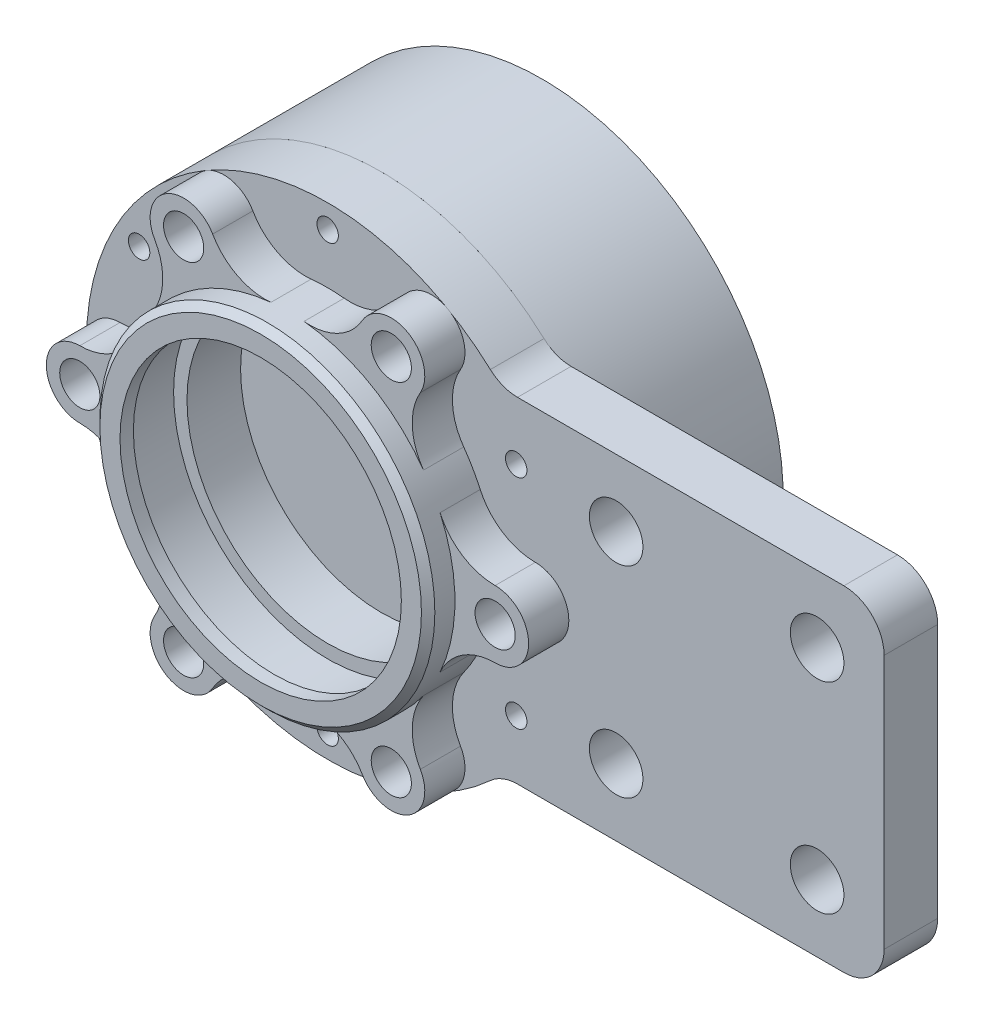
from build123d import *

# Parameters (mm, degrees)
SKETCH_1_R          = 12.5
SKETCH_1_R_2        = 10.5
EXTRUDE_1_DEPTH     = 1
EXTRUDE_START       = 4
SKETCH_2_R          = 12.5
SKETCH_2_R_2        = 11.5
EXTRUDE_2_DEPTH     = 4
SKETCH_3_R          = 1.5
EXTRUDE_4_DEPTH     = 3
SKETCH_4_R          = 1.25
SKETCH_4_R_2        = 10.5
EXTRUDE_5_DEPTH     = 4
CHAMFER_1_SIZE      = 0.5
CUT_EXTRUDE_1_DEPTH = 10
SKETCH_14_R         = 1.25
EXTRUDE_6_DEPTH     = 4
SKETCH_15_R         = 18
EXTRUDE_7_DEPTH     = 12
SKETCH_18_R         = 0.8
CUT_EXTRUDE_2_DEPTH = 4
EXTRUDE_8_DEPTH     = 4
SKETCH_20_R         = 2
CUT_EXTRUDE_3_DEPTH = 4
FILLET_1_R          = 3


with BuildPart() as part:
    # 草图1 → 凸台-拉伸1 (new body)
    with BuildSketch(Plane.XY):
        Circle(SKETCH_1_R)
        Circle(SKETCH_1_R_2, mode=Mode.SUBTRACT)
    extrude(amount=EXTRUDE_1_DEPTH)

    # 草图2 → 凸台-拉伸2 (add)
    with BuildSketch(Plane(origin=(0, 0, 0), x_dir=(-1, 0, 0), z_dir=(0, 0, -1)).offset(EXTRUDE_START)):
        Circle(SKETCH_2_R)
        Circle(SKETCH_2_R_2, mode=Mode.SUBTRACT)
    extrude(amount=-EXTRUDE_2_DEPTH)

    # 草图3 → 凸台-拉伸4 (add)
    # profile 1 of 6: a face of its own
    with BuildSketch(Plane(origin=(0, 0, -4), x_dir=(-1, 0, 0), z_dir=(0, 0, -1))):
        with BuildLine():
            ThreePointArc((9.915063383, 12.173393832), (8.999999927, 15.588457141), (5.584936617, 14.673393685))
            ThreePointArc((5.584936617, 14.673393685), (3.73765178, 12.915125295), (1.232179975, 12.439121051))
            ThreePointArc((1.232179975, 12.439121051), (6.25, 10.825317547), (10.156504843, 7.286659685))
            ThreePointArc((10.156504843, 7.286659685), (9.316000708, 9.694464039), (9.915063383, 12.173393832))
        make_face()
        with Locations((7.75, 13.423393759)):
            Circle(SKETCH_3_R, mode=Mode.SUBTRACT)
    # profile 2 of 6: a face of its own
    with BuildSketch(Plane(origin=(0, 0, -4), x_dir=(-1, 0, 0), z_dir=(0, 0, -1))):
        with BuildLine():
            ThreePointArc((-11.388684818, 5.152461365), (-12.5, 0), (-11.388684818, -5.152461365))
            ThreePointArc((-11.388684818, -5.152461365), (-13.053652488, -3.220661256), (-15.5, -2.499999853))
            ThreePointArc((-15.5, -2.499999853), (-17.999999853, 0), (-15.5, 2.499999853))
            ThreePointArc((-15.5, 2.499999853), (-13.053652488, 3.220661256), (-11.388684818, 5.152461365))
        make_face()
        with Locations((-15.5, 0)):
            Circle(SKETCH_3_R, mode=Mode.SUBTRACT)
    # profile 3 of 6: a face of its own
    with BuildSketch(Plane(origin=(0, 0, -4), x_dir=(-1, 0, 0), z_dir=(0, 0, -1))):
        with BuildLine():
            ThreePointArc((15.5, 2.499999853), (13.053652488, 3.220661256), (11.388684818, 5.152461365))
            ThreePointArc((11.388684818, 5.152461365), (12.5, 0), (11.388684818, -5.152461365))
            ThreePointArc((11.388684818, -5.152461365), (13.053652488, -3.220661256), (15.5, -2.499999853))
            ThreePointArc((15.5, -2.499999853), (17.999999853, 0), (15.5, 2.499999853))
        make_face()
        with Locations((15.5, 0)):
            Circle(SKETCH_3_R, mode=Mode.SUBTRACT)
    # profile 4 of 6: a face of its own
    with BuildSketch(Plane(origin=(0, 0, -4), x_dir=(-1, 0, 0), z_dir=(0, 0, -1))):
        with BuildLine():
            ThreePointArc((9.915063383, -12.173393832), (9.316000708, -9.694464039), (10.156504843, -7.286659685))
            ThreePointArc((10.156504843, -7.286659685), (6.25, -10.825317547), (1.232179975, -12.439121051))
            ThreePointArc((1.232179975, -12.439121051), (3.73765178, -12.915125295), (5.584936617, -14.673393685))
            ThreePointArc((5.584936617, -14.673393685), (8.999999927, -15.588457141), (9.915063383, -12.173393832))
        make_face()
        with Locations((7.75, -13.423393759)):
            Circle(SKETCH_3_R, mode=Mode.SUBTRACT)
    # profile 5 of 6: a face of its own
    with BuildSketch(Plane(origin=(0, 0, -4), x_dir=(-1, 0, 0), z_dir=(0, 0, -1))):
        with BuildLine():
            ThreePointArc((-5.584936617, -14.673393685), (-3.73765178, -12.915125295), (-1.232179975, -12.439121051))
            ThreePointArc((-1.232179975, -12.439121051), (-6.25, -10.825317547), (-10.156504843, -7.286659685))
            ThreePointArc((-10.156504843, -7.286659685), (-9.316000708, -9.694464039), (-9.915063383, -12.173393832))
            ThreePointArc((-9.915063383, -12.173393832), (-8.999999927, -15.588457141), (-5.584936617, -14.673393685))
        make_face()
        with Locations((-7.75, -13.423393759)):
            Circle(SKETCH_3_R, mode=Mode.SUBTRACT)
    # profile 6 of 6: a face of its own
    with BuildSketch(Plane(origin=(0, 0, -4), x_dir=(-1, 0, 0), z_dir=(0, 0, -1))):
        with BuildLine():
            ThreePointArc((-9.915063383, 12.173393832), (-9.316000708, 9.694464039), (-10.156504843, 7.286659685))
            ThreePointArc((-10.156504843, 7.286659685), (-6.25, 10.825317547), (-1.232179975, 12.439121051))
            ThreePointArc((-1.232179975, 12.439121051), (-3.73765178, 12.915125295), (-5.584936617, 14.673393685))
            ThreePointArc((-5.584936617, 14.673393685), (-8.999999927, 15.588457141), (-9.915063383, 12.173393832))
        make_face()
        with Locations((-7.75, 13.423393759)):
            Circle(SKETCH_3_R, mode=Mode.SUBTRACT)
    extrude(amount=-EXTRUDE_4_DEPTH)

    # 倒角1
    chamfer_1_edges = [part.edges().sort_by_distance(p)[0] for p in [
        (-12.5, 0, 1),
    ]]
    chamfer(chamfer_1_edges, length=CHAMFER_1_SIZE)


with BuildPart() as body_2:
    # 草图4 → 凸台-拉伸5 (new body)
    with BuildSketch(Plane(origin=(0, 0, -4), x_dir=(-1, 0, 0), z_dir=(0, 0, -1))):
        with BuildLine():
            Line((-18, 0), (-18, -26))
            Line((-18, -26), (18, -26))
            Line((18, -26), (18, 0))
            ThreePointArc((18, 0), (0, 18), (-18, 0))
        make_face()
        with Locations((7.75, 13.423393759)):
            Circle(SKETCH_4_R, mode=Mode.SUBTRACT)
        Circle(SKETCH_4_R_2, mode=Mode.SUBTRACT)
        with Locations((13.423393759, 7.75)):
            Circle(SKETCH_4_R, mode=Mode.SUBTRACT)
        with Locations((15.5, 0)):
            Circle(SKETCH_4_R, mode=Mode.SUBTRACT)
        with Locations((13.423393759, -7.75)):
            Circle(SKETCH_4_R, mode=Mode.SUBTRACT)
        with Locations((7.75, -13.423393759)):
            Circle(SKETCH_4_R, mode=Mode.SUBTRACT)
        with Locations((0, -15.5)):
            Circle(SKETCH_4_R, mode=Mode.SUBTRACT)
        with Locations((-7.75, -13.423393759)):
            Circle(SKETCH_4_R, mode=Mode.SUBTRACT)
        with Locations((-13.423393759, -7.75)):
            Circle(SKETCH_4_R, mode=Mode.SUBTRACT)
        with Locations((-15.5, 0)):
            Circle(SKETCH_4_R, mode=Mode.SUBTRACT)
        with Locations((-13.423393759, 7.75)):
            Circle(SKETCH_4_R, mode=Mode.SUBTRACT)
        with Locations((-7.75, 13.423393759)):
            Circle(SKETCH_4_R, mode=Mode.SUBTRACT)
        with Locations((0, 15.5)):
            Circle(SKETCH_4_R, mode=Mode.SUBTRACT)
    extrude(amount=EXTRUDE_5_DEPTH)

    # 草图13 → 切除-拉伸1 (cut)
    with BuildSketch(Plane(origin=(0, 0, -8), x_dir=(-1, 0, 0), z_dir=(0, 0, -1))):
        with BuildLine():
            ThreePointArc((18, 0), (0, -18), (-18, 0))
            Line((-18, 0), (-18, -26))
            Line((-18, -26), (18, -26))
            Line((18, -26), (18, 0))
        make_face()
    extrude(amount=-CUT_EXTRUDE_1_DEPTH, mode=Mode.SUBTRACT)

    # 草图14 → 凸台-拉伸6 (add)
    with BuildSketch(Plane.XY.offset(-4)):
        with Locations((0, 15.5)):
            Circle(SKETCH_14_R)
        with Locations((13.423393759, 7.75)):
            Circle(SKETCH_14_R)
        with Locations((13.423393759, -7.75)):
            Circle(SKETCH_14_R)
        with Locations((0, -15.5)):
            Circle(SKETCH_14_R)
        with Locations((-13.423393759, -7.75)):
            Circle(SKETCH_14_R)
        with Locations((-13.423393759, 7.75)):
            Circle(SKETCH_14_R)
    extrude(amount=-EXTRUDE_6_DEPTH)

    # 草图18 → 切除-拉伸2 (cut)
    with BuildSketch(Plane(origin=(0, 0, -8), x_dir=(-1, 0, 0), z_dir=(0, 0, -1))):
        with Locations((0, 16.25)):
            Circle(SKETCH_18_R)
        with Locations((14.072912811, 8.125)):
            Circle(SKETCH_18_R)
        with Locations((14.072912811, -8.125)):
            Circle(SKETCH_18_R)
        with Locations((0, -16.25)):
            Circle(SKETCH_18_R)
        with Locations((-14.072912811, -8.125)):
            Circle(SKETCH_18_R)
        with Locations((-14.072912811, 8.125)):
            Circle(SKETCH_18_R)
    extrude(amount=-CUT_EXTRUDE_2_DEPTH, mode=Mode.SUBTRACT)

    # 草图19 → 凸台-拉伸8 (add)
    with BuildSketch(Plane(origin=(0, 0, -8), x_dir=(-1, 0, 0), z_dir=(0, 0, -1))):
        with BuildLine():
            Line((-41.531361747, -12.5), (-12.951833847, -12.5))
            ThreePointArc((-12.951833847, -12.5), (-18, 0), (-12.951833847, 12.5))
            Line((-12.951833847, 12.5), (-41.531361747, 12.5))
            Line((-41.531361747, 12.5), (-41.531361747, -12.5))
        make_face()
    extrude(amount=-EXTRUDE_8_DEPTH)

    # 草图20 → 切除-拉伸3 (cut)
    with BuildSketch(Plane(origin=(0, 0, -8), x_dir=(-1, 0, 0), z_dir=(0, 0, -1))):
        with Locations((-21.531361747, 7.5)):
            Circle(SKETCH_20_R)
        with Locations((-21.531361747, -7.5)):
            Circle(SKETCH_20_R)
        with Locations((-36.531361747, -7.5)):
            Circle(SKETCH_20_R)
        with Locations((-36.531361747, 7.5)):
            Circle(SKETCH_20_R)
    extrude(amount=-CUT_EXTRUDE_3_DEPTH, mode=Mode.SUBTRACT)

    # 圆角1
    fillet_1_edges = [body_2.edges().sort_by_distance(p)[0] for p in [
        (12.951833847, 12.5, -6),
        (41.531361747, -12.5, -6),
        (12.951833847, -12.5, -6),
        (41.531361747, 12.5, -6),
    ]]
    fillet(fillet_1_edges, radius=FILLET_1_R)


with BuildPart() as body_3:
    # 草图15 → 凸台-拉伸7 (new body)
    with BuildSketch(Plane(origin=(0, 0, -8), x_dir=(-1, 0, 0), z_dir=(0, 0, -1))):
        Circle(SKETCH_15_R)
    extrude(amount=EXTRUDE_7_DEPTH)


solid = Compound([part.part, body_2.part, body_3.part])
